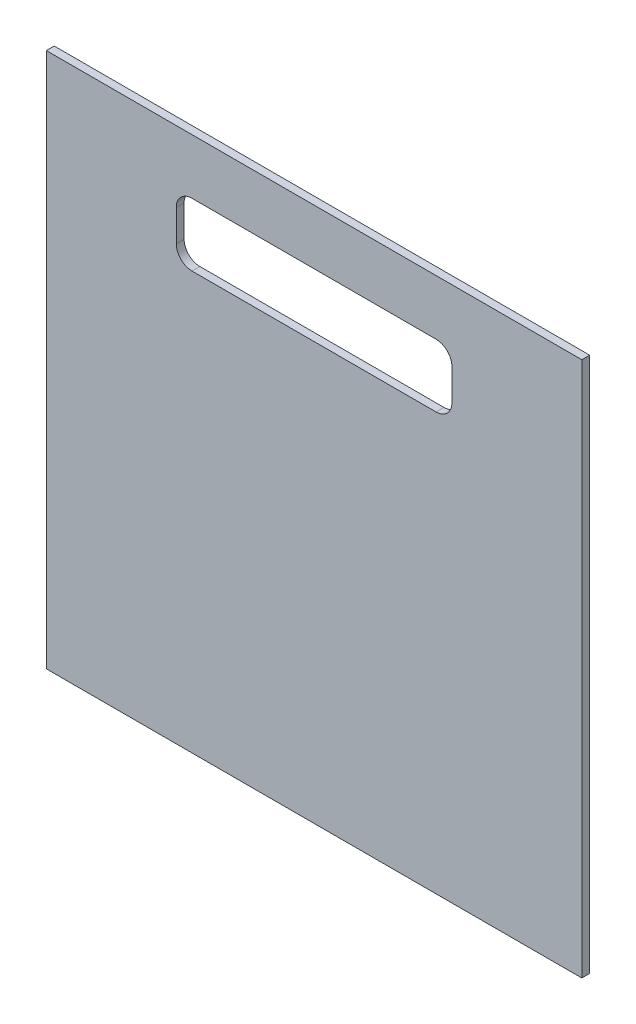
from build123d import *

# Parameters (mm, degrees)
SKETCH_1_W      = 68
SKETCH_1_H      = 68
EXTRUDE_1_DEPTH = 1


with BuildPart() as part:
    # 草图1 → 凸台-拉伸1 (new body)
    with BuildSketch(Plane.XY):
        Rectangle(SKETCH_1_W, SKETCH_1_H)
        with BuildLine():
            Line((15.5, 19), (-15.5, 19))
            ThreePointArc((-15.5, 19), (-16.914213562, 19.585786438), (-17.5, 21))
            Line((-17.5, 21), (-17.5, 25))
            ThreePointArc((-17.5, 25), (-16.914213562, 26.414213562), (-15.5, 27))
            Line((-15.5, 27), (15.5, 27))
            ThreePointArc((15.5, 27), (16.914213562, 26.414213562), (17.5, 25))
            Line((17.5, 25), (17.5, 21))
            ThreePointArc((17.5, 21), (16.914213562, 19.585786438), (15.5, 19))
        make_face(mode=Mode.SUBTRACT)
    extrude(amount=EXTRUDE_1_DEPTH)


solid = part.part
